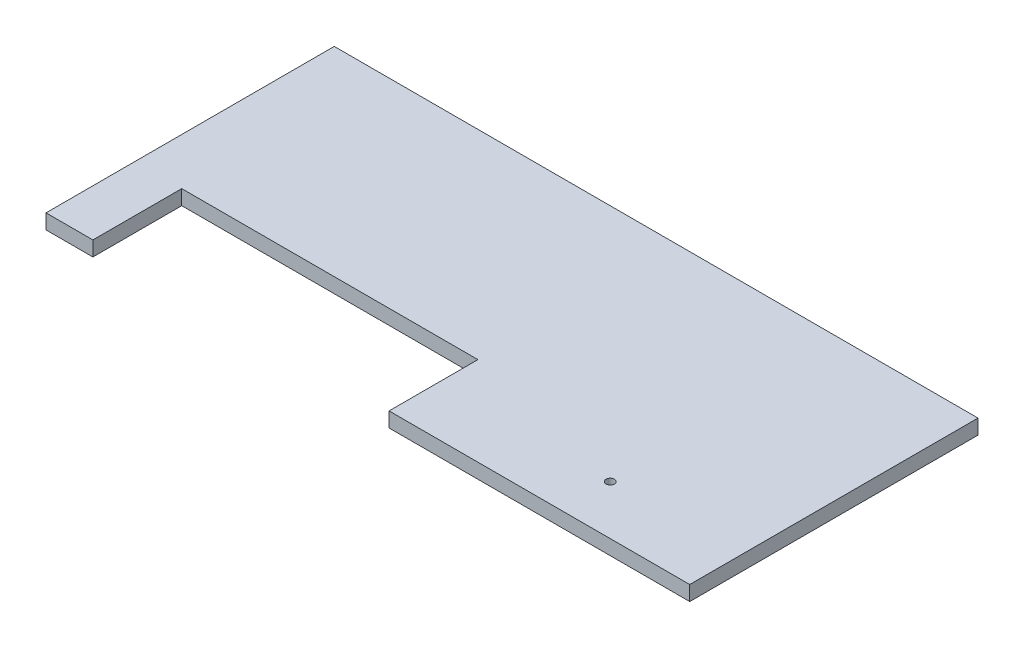
from build123d import *

# Parameters (mm, degrees)
BOSS_EXTRUDE1_DEPTH = 3
SKETCH2_R           = 0.85
CUT_EXTRUDE1_DEPTH  = 143.920705638


with BuildPart() as part:
    # Sketch1 → Boss-Extrude1 (new body)
    with BuildSketch(Plane(origin=(0, 0, 0), x_dir=(1, 0, 0), z_dir=(0, 1, 0))):
        Polygon((130.41, 0), (0, 0), (0, -58.4), (9.5, -58.4), (9.5, -40.4), (69.5, -40.4), (69.5, -58.4), (130.41, -58.4), align=None)
    extrude(amount=BOSS_EXTRUDE1_DEPTH)

    # Sketch2 → Cut-Extrude1 (cut, through all)
    with BuildSketch(Plane(origin=(0, 3, 0), x_dir=(1, 0, 0), z_dir=(0, 1, 0))):
        with Locations(Location((104.3, -48.4, 0), (0, 0, 270))):
            Circle(SKETCH2_R)
    extrude(amount=-CUT_EXTRUDE1_DEPTH, mode=Mode.SUBTRACT)


solid = part.part
